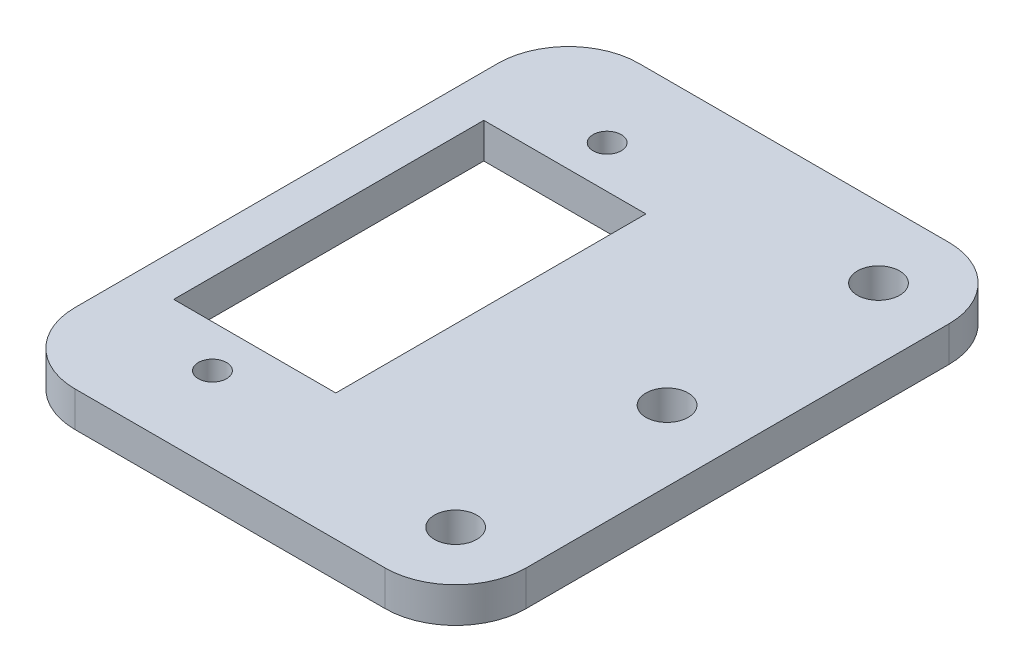
from build123d import *

# Parameters (mm, degrees)
SKETCH1_W           = 32
SKETCH1_H           = 40
SKETCH1_R           = 1.5
SKETCH1_R_2         = 1
SKETCH1_W_2         = 11.5
SKETCH1_H_2         = 22
BOSS_EXTRUDE1_DEPTH = 2.5
FILLET1_R           = 5


with BuildPart() as part:
    # Sketch1 → Boss-Extrude1 (new body)
    with BuildSketch(Plane(origin=(0, 0, 0), x_dir=(1, 0, 0), z_dir=(0, 1, 0))):
        Rectangle(SKETCH1_W, SKETCH1_H)
        with Locations(Location((11, 15, 0), (0, 0, 270))):
            Circle(SKETCH1_R, mode=Mode.SUBTRACT)
        with Locations(Location((11, 0, 0), (0, 0, 270))):
            Circle(SKETCH1_R, mode=Mode.SUBTRACT)
        with Locations(Location((11, -15, 0), (0, 0, 270))):
            Circle(SKETCH1_R, mode=Mode.SUBTRACT)
        with Locations(Location((-7.25, -14, 0), (0, 0, 270))):
            Circle(SKETCH1_R_2, mode=Mode.SUBTRACT)
        with Locations(Location((-7.25, 14, 0), (0, 0, 90))):
            Circle(SKETCH1_R_2, mode=Mode.SUBTRACT)
        with Locations((-7.25, 0)):
            Rectangle(SKETCH1_W_2, SKETCH1_H_2, mode=Mode.SUBTRACT)
    extrude(amount=BOSS_EXTRUDE1_DEPTH)

    # Fillet1
    fillet1_edges = [part.edges().sort_by_distance(p)[0] for p in [
        (-16, 1.25, -20),
        (16, 1.25, -20),
        (16, 1.25, 20),
        (-16, 1.25, 20),
    ]]
    fillet(fillet1_edges, radius=FILLET1_R)


solid = part.part
